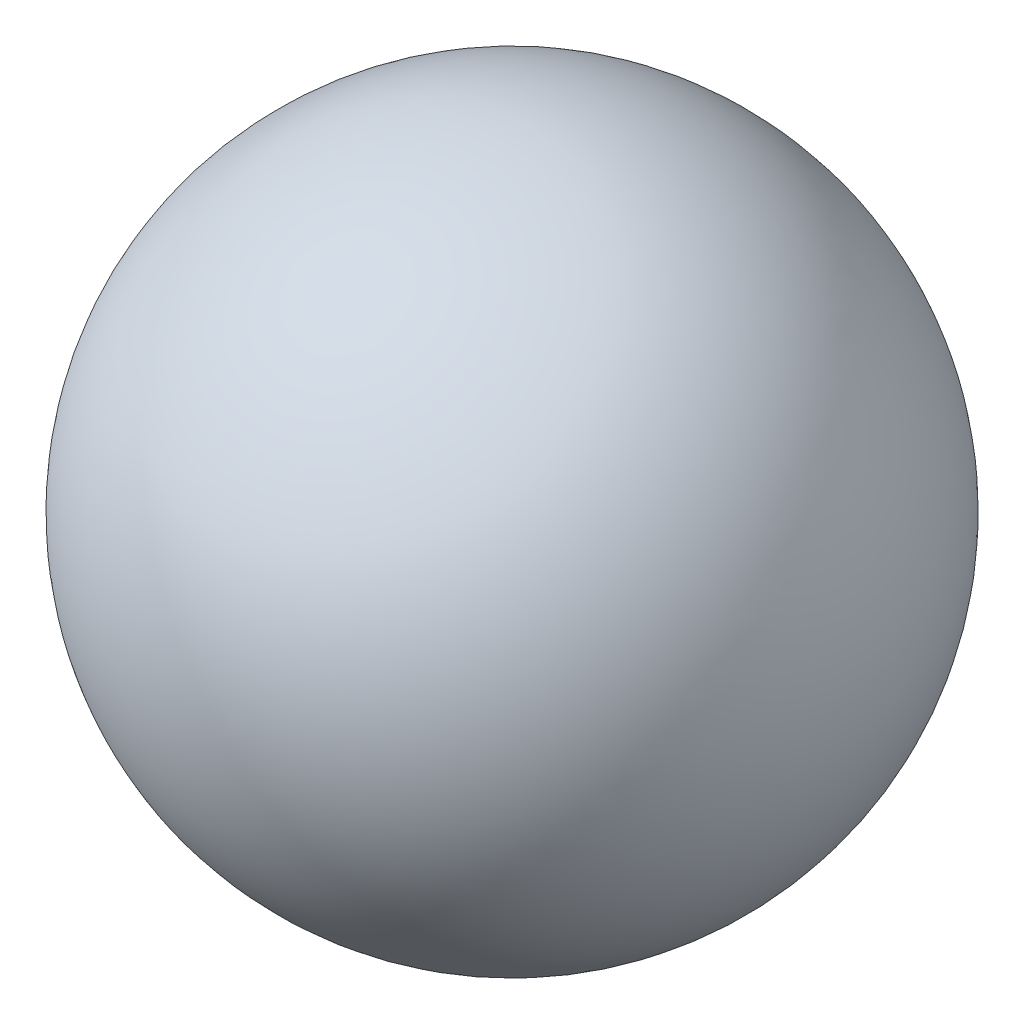
from build123d import *


with BuildPart() as part:
    # Sketch1 → Revolve1 (revolve)
    with BuildSketch(Plane(origin=(0, 0, 0), x_dir=(-1, 0, 0), z_dir=(0, 1, 0))):
        with BuildLine():
            Line((0, 28.5), (0, -28.5))
            ThreePointArc((0, -28.5), (-28.5, 0), (0, 28.5))
        make_face()
    revolve(axis=Axis((0, 0, 28.5), (0, 0, -1)))


solid = part.part
